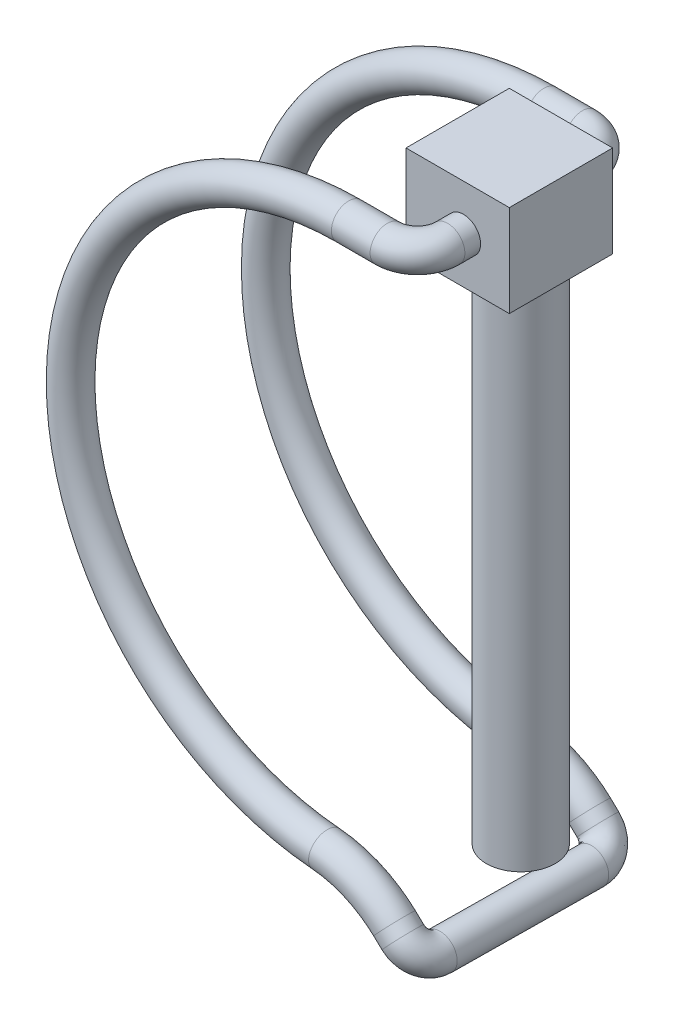
from build123d import *

# Parameters (mm, degrees)
SZKIC1_R                    = 1.5
DODANIE_WYCI_GNI_CIE1_DEPTH = 22
SZKIC2_W                    = 4.5
SZKIC2_H                    = 4.5
DODANIE_WYCI_GNI_CIE2_DEPTH = 4
SZKIC3_R                    = 0.75
SZKIC4_R                    = 0.75


with BuildPart() as part:
    # Szkic1 → Dodanie-wyciągnięcie1 (new body)
    with BuildSketch(Plane(origin=(0, 0, 0), x_dir=(1, 0, 0), z_dir=(0, 1, 0))):
        with Locations(Location((0, 0, 0), (0, 0, 270))):
            Circle(SZKIC1_R)
    extrude(amount=DODANIE_WYCI_GNI_CIE1_DEPTH)

    # Szkic2 → Dodanie-wyciągnięcie2 (add)
    with BuildSketch(Plane(origin=(0, 22, 0), x_dir=(1, 0, 0), z_dir=(0, 1, 0))):
        with Locations((-0.5, 0)):
            Rectangle(SZKIC2_W, SZKIC2_H)
    extrude(amount=DODANIE_WYCI_GNI_CIE2_DEPTH)

    # Wyciągnięcie po ścieżce1: sweep along a curve in space
    with BuildLine() as wyci_gni_cie_po_cie_ce1_path:
        Line((-0.25, 24, 2.25), (-0.25, 24, 2.935752061))
        ThreePointArc((-0.25, 24, 2.935752061), (-0.634934309, 24, 3.865065691), (-1.564247939, 24, 4.25))
        Line((-1.564247939, 24, 4.25), (-3.25, 24, 4.25))
        ThreePointArc((-3.25, 24, 4.25), (-15.350180002, 12.386598924, 4.25), (-4.243124016, -0.179973718, 4.25))
        ThreePointArc((-4.243124016, -0.179973718, 4.25), (-2.635553851, -0.588278854, 4.25), (-1.25, -1.5, 4.25))
    # Szkic3 → Wyciągnięcie po ścieżce1 (sweep)
    with BuildSketch(Plane.XY.offset(2.25)):
        with Locations((-0.25, 24)):
            Circle(SZKIC3_R)
    wyci_gni_cie_po_cie_ce1 = sweep(path=wyci_gni_cie_po_cie_ce1_path.line)

    # Lustro1: Wyciągnięcie po ścieżce1 across plane
    add(wyci_gni_cie_po_cie_ce1.mirror(Plane.XY))

    # Wyciągnięcie po ścieżce3: sweep along a path in Szkic5
    with BuildLine(Plane(origin=(-1.3270452, -1.428422831, 0), x_dir=(0.7326050310980656, -0.6806107887241551, 0.007669594649387885), z_dir=(0.6806308072833431, 0.7326265789451163, 0))) as wyci_gni_cie_po_cie_ce3_path:
        Line((0.137755671, -4.249068442), (0.637755671, -4.249068442))
        ThreePointArc((0.637755671, -4.249068442), (1.298765062, -3.975269388), (1.572564117, -3.314259997))
        Line((1.572564117, -3.314259997), (1.572564117, 3.250681557))
        ThreePointArc((1.572564117, 3.250681557), (1.279670898, 3.957788339), (0.572564117, 4.250681557))
        Line((0.572564117, 4.250681557), (0.072564117, 4.250681557))
    # Szkic4 → Wyciągnięcie po ścieżce3 (sweep)
    with BuildSketch(Plane(origin=(0.0770452, -0.071577169, 0), x_dir=(0, 0, -1), z_dir=(0.7326265789451163, -0.6806308072833431, 0))):
        with Locations((-4.25, -1.949728378)):
            Circle(SZKIC4_R)
    sweep(path=wyci_gni_cie_po_cie_ce3_path.line)


solid = part.part
